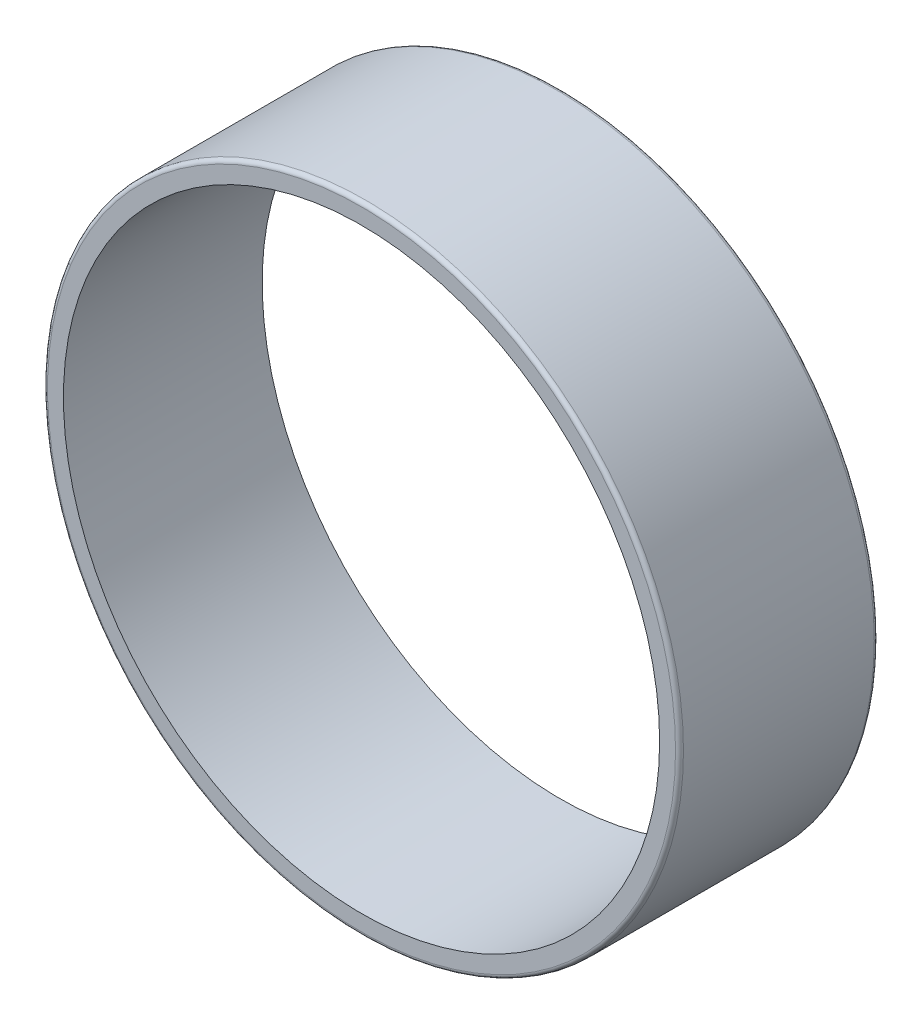
from build123d import *

# Parameters (mm, degrees)
IZIM1_R                     = 8
IZIM1_R_2                   = 7.5
Y_KSEKLIK_EKSTR_ZYON2_DEPTH = 5
RADYUS2_R                   = 0.1


with BuildPart() as part:
    # Çizim1 → Yükseklik-Ekstrüzyon2 (new body)
    with BuildSketch(Plane.XY):
        Circle(IZIM1_R)
        Circle(IZIM1_R_2, mode=Mode.SUBTRACT)
    extrude(amount=Y_KSEKLIK_EKSTR_ZYON2_DEPTH)

    # Radyus2
    radyus2_edges = [part.edges().sort_by_distance(p)[0] for p in [
        (-8, 0, 0),
        (-8, 0, 5),
    ]]
    fillet(radyus2_edges, radius=RADYUS2_R)


solid = part.part
